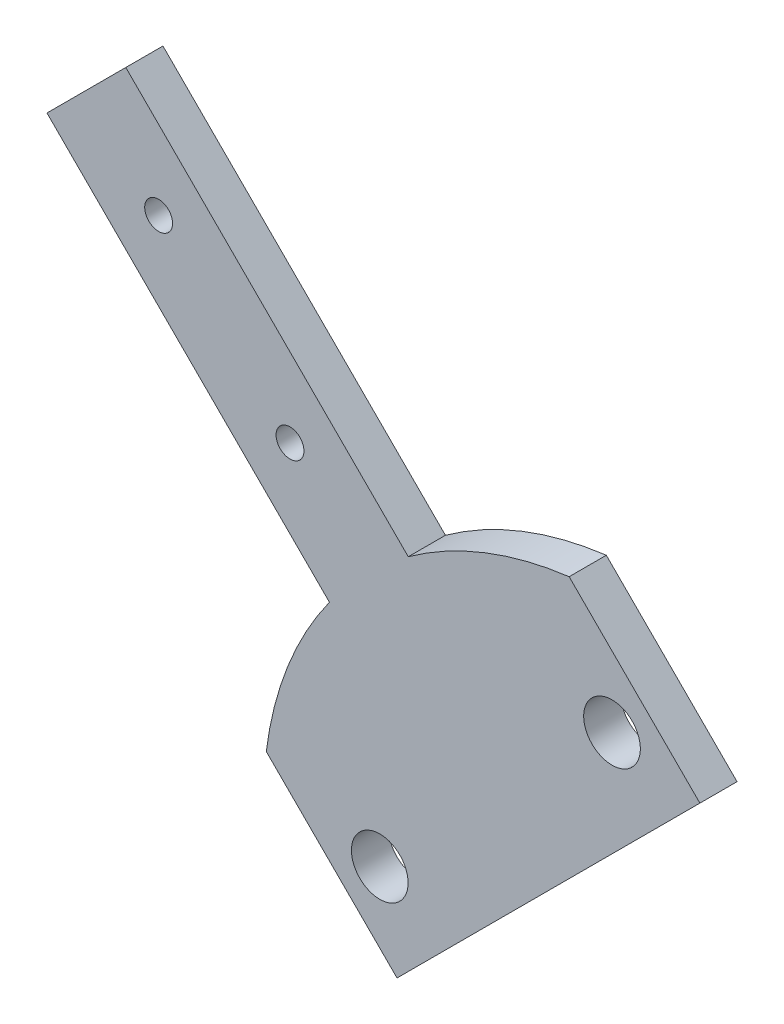
from build123d import *

# Parameters (mm, degrees)
SKETCH2_R           = 3.05
SKETCH2_R_2         = 1.5
BOSS_EXTRUDE1_DEPTH = 4


with BuildPart() as part:
    # Sketch2 → Boss-Extrude1 (new body)
    with BuildSketch(Plane.XY):
        with BuildLine():
            Line((-23.142573846, -9.456282345), (9.456282345, 23.142573846))
            Line((9.456282345, 23.142573846), (-4.615964413, 37.214820603))
            ThreePointArc((-4.615964413, 37.214820603), (-13.702289069, 34.906980309), (-21.932251863, 30.417533237))
            Line((-21.932251863, 30.417533237), (-52.337843454, 60.823124828))
            Line((-52.337843454, 60.823124828), (-60.823124828, 52.337843454))
            Line((-60.823124828, 52.337843454), (-30.417533237, 21.932251863))
            ThreePointArc((-30.417533237, 21.932251863), (-34.906980309, 13.702289069), (-37.214820603, 4.615964413))
            Line((-37.214820603, 4.615964413), (-23.142573846, -9.456282345))
        make_face()
        with Locations((0, 25)):
            Circle(SKETCH2_R, mode=Mode.SUBTRACT)
        with Locations((-25, 0)):
            Circle(SKETCH2_R, mode=Mode.SUBTRACT)
        with Locations((-48.802309548, 48.802309548)):
            Circle(SKETCH2_R_2, mode=Mode.SUBTRACT)
        with Locations((-34.660173924, 34.660173924)):
            Circle(SKETCH2_R_2, mode=Mode.SUBTRACT)
    extrude(amount=BOSS_EXTRUDE1_DEPTH)


solid = part.part
